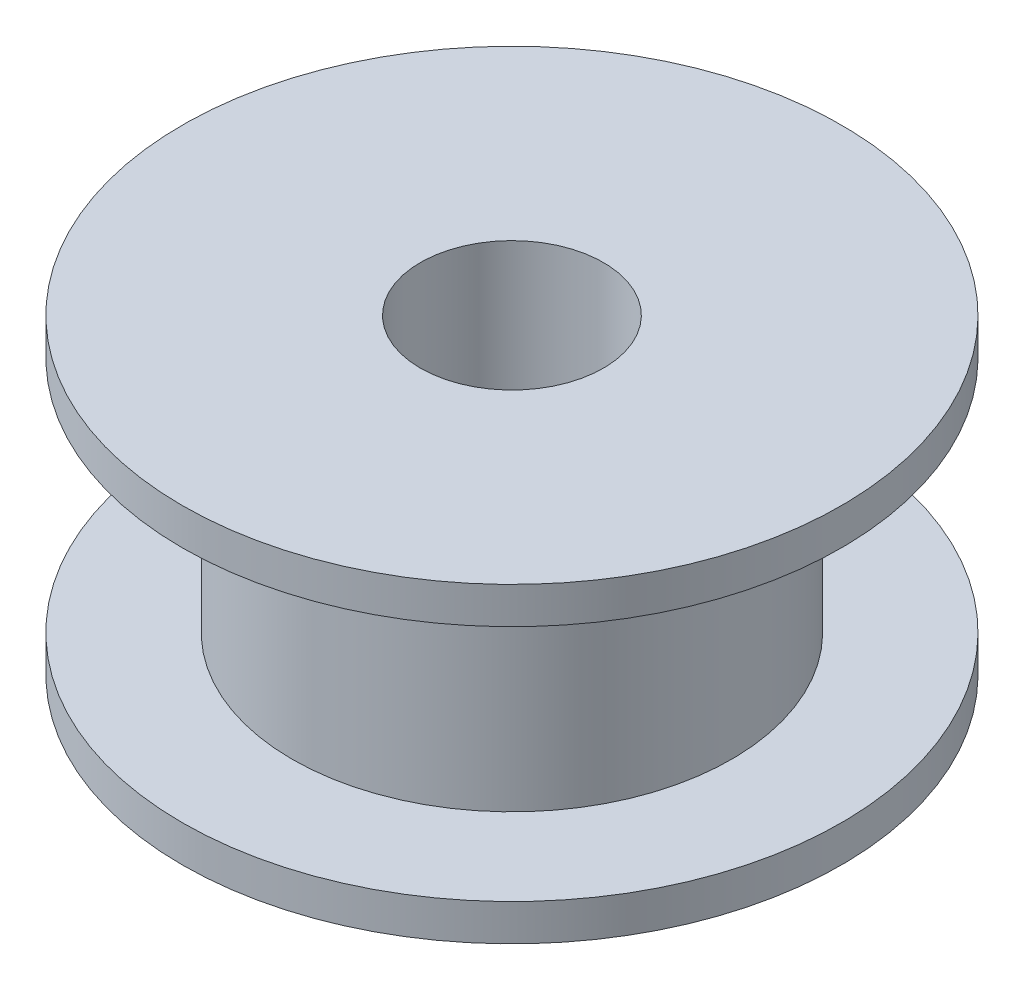
from build123d import *

# Parameters (mm, degrees)
CUT_EXTRUDE_1_REACH = 17.305
SKETCH_2_R          = 2.5


with BuildPart() as part:
    # 草图1 → 旋转1 (revolve)
    with BuildSketch(Plane.XY, mode=Mode.PRIVATE) as revolve_1_sk:
        Polygon((0, 4.25), (0, -4.25), (9, -4.25), (9, -3.25), (6, -3.25), (6, 3.25), (9, 3.25), (9, 4.25), align=None)
    revolve(revolve_1_sk.sketch.rotate(Axis((0, 4.25, 0), (0, -1, 0)), 90), axis=Axis((0, 4.25, 0), (0, -1, 0)))

    # 草图2 → 切除-拉伸1 (cut, up to next)
    with BuildSketch(Plane(origin=(0, 4.25, 0), x_dir=(1, 0, 0), z_dir=(0, 1, 0)), mode=Mode.PRIVATE) as cut_extrude_1_sk1:
        with Locations(Location((0, 0, 0), (0, 0, 270))):
            Circle(SKETCH_2_R)
    cut_extrude_1_tool1 = extrude(cut_extrude_1_sk1.sketch, amount=-CUT_EXTRUDE_1_REACH, mode=Mode.PRIVATE) & part.part
    add(cut_extrude_1_tool1.solids().sort_by_distance((0, 4.25, 0))[0], mode=Mode.SUBTRACT)


solid = part.part
